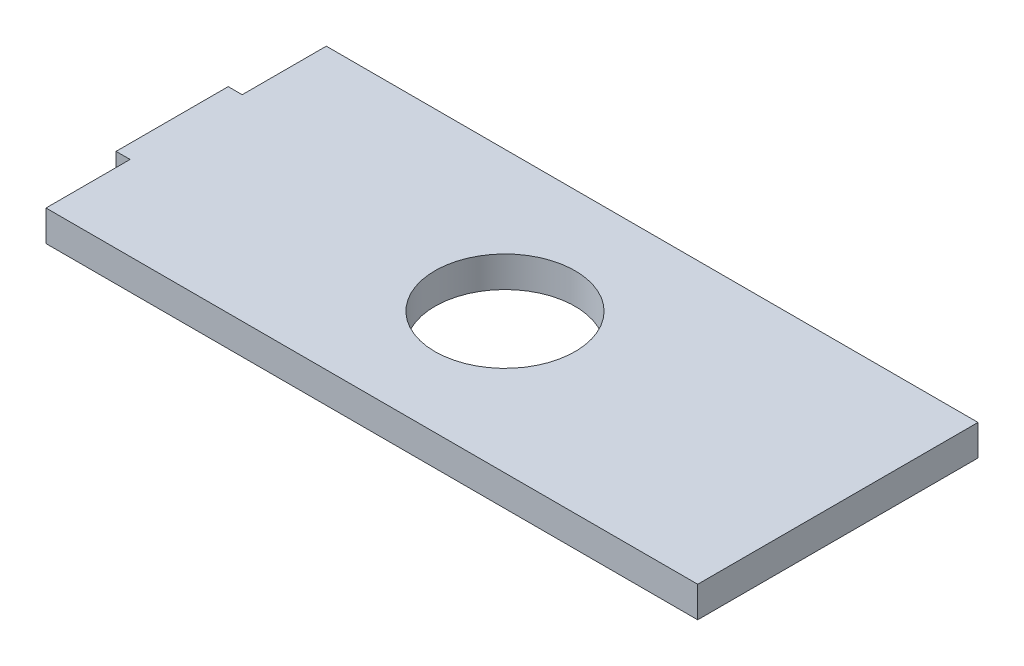
from build123d import *

# Parameters (mm, degrees)
SKETCH1_R           = 5
BOSS_EXTRUDE1_DEPTH = 2.2


with BuildPart() as part:
    # Sketch1 → Boss-Extrude1 (new body)
    with BuildSketch(Plane(origin=(0, 0, 0), x_dir=(1, 0, 0), z_dir=(0, 1, 0))):
        Polygon((-89.5, 22.597712716), (-89.5, 16.597712716), (-43, 16.597712716), (-43, 23.597712716), (-43, 29.597712716), (-43, 36.597712716), (-89.5, 36.597712716), (-89.5, 30.597712716), (-90.5, 30.597712716), (-90.5, 22.597712716), align=None)
        with Locations(Location((-66.75, 26.597712716, 0), (0, 0, 270))):
            Circle(SKETCH1_R, mode=Mode.SUBTRACT)
    extrude(amount=BOSS_EXTRUDE1_DEPTH)


solid = part.part
